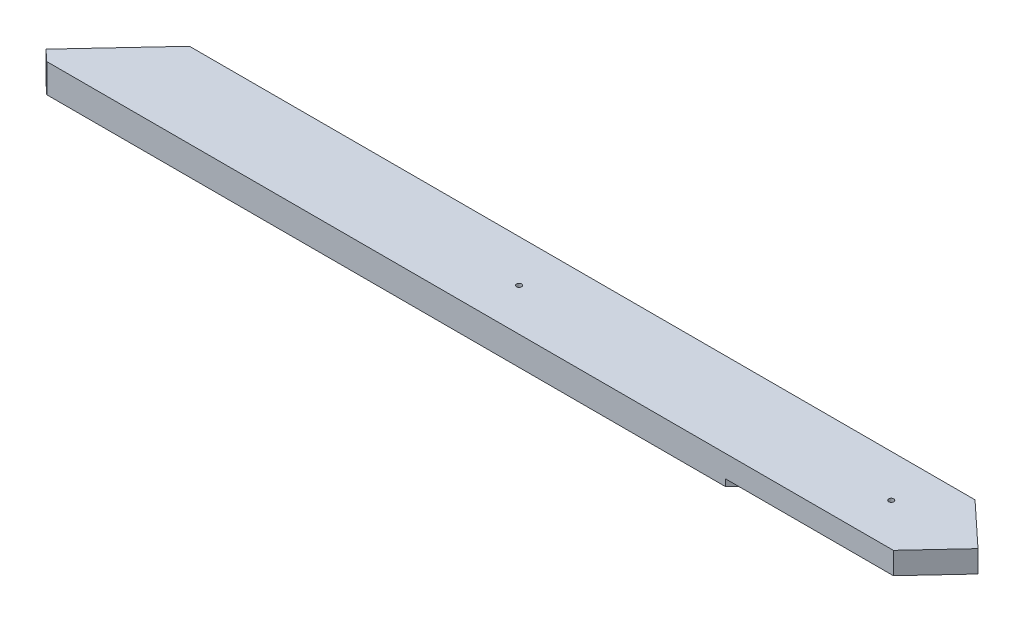
from build123d import *

# Parameters (mm, degrees)
SKETCH1_W           = 1100
SKETCH1_H           = 100
BOSS_EXTRUDE1_DEPTH = 34
SKETCH2_R           = 3
CUT_EXTRUDE1_DEPTH  = 554.313654269
LPATTERN1_COUNT     = 2
LPATTERN1_PITCH     = 440
CUT_EXTRUDE2_DEPTH  = 554.313654269
CUT_EXTRUDE3_DEPTH  = 554.313654269
CUT_EXTRUDE4_DEPTH  = 8


with BuildPart() as part:
    # Sketch1 → Boss-Extrude1 (new body)
    with BuildSketch(Plane(origin=(0, 0, 0), x_dir=(1, 0, 0), z_dir=(0, 1, 0))):
        Rectangle(SKETCH1_W, SKETCH1_H)
    extrude(amount=BOSS_EXTRUDE1_DEPTH)

    # Sketch2 → Cut-Extrude1 (cut, through all)
    with BuildSketch(Plane(origin=(0, 34, 0), x_dir=(1, 0, 0), z_dir=(0, 1, 0))):
        with Locations(Location((0, 0, 0), (0, 0, 270))):
            Circle(SKETCH2_R)
    cut_extrude1 = extrude(amount=-CUT_EXTRUDE1_DEPTH, mode=Mode.SUBTRACT)

    # LPattern1: Cut-Extrude1 ×2
    with Locations(*[(i * LPATTERN1_PITCH, 0, 0) for i in range(1, LPATTERN1_COUNT)]):
        add(cut_extrude1, mode=Mode.SUBTRACT)

    # Sketch3 → Cut-Extrude2 (cut, through all)
    with BuildSketch(Plane(origin=(0, 34, 0), x_dir=(1, 0, 0), z_dir=(0, 1, 0))):
        Polygon((540.762594459, 1.774699353), (414.907482272, 119.078541768), (523.885555732, 236.000949243), (780.808453445, 33.355832904), (490.286548009, -251.902570915), (394.883300151, -154.73897124), align=None)
    extrude(amount=-CUT_EXTRUDE2_DEPTH, mode=Mode.SUBTRACT)

    # Sketch4 → Cut-Extrude3 (cut, through all)
    with BuildSketch(Plane.XZ):
        Polygon((-439.548903775, -50), (-521.367085593, 37.782601488), (-461.555021583, 93.530713814), (-639.566149279, 284.518579051), (-887.964366722, 45.983956755), (-622.18599326, -220.227748335), align=None)
    extrude(amount=-CUT_EXTRUDE3_DEPTH, mode=Mode.SUBTRACT)

    # Sketch5 → Cut-Extrude4 (cut)
    with BuildSketch(Plane.XZ):
        Polygon((457.65907548, -125.279728267), (196.673608083, 154.731178471), (458.273207913, 338.877030437), (810.658904172, -71.072769519), align=None)
    extrude(amount=-CUT_EXTRUDE4_DEPTH, mode=Mode.SUBTRACT)


solid = part.part
